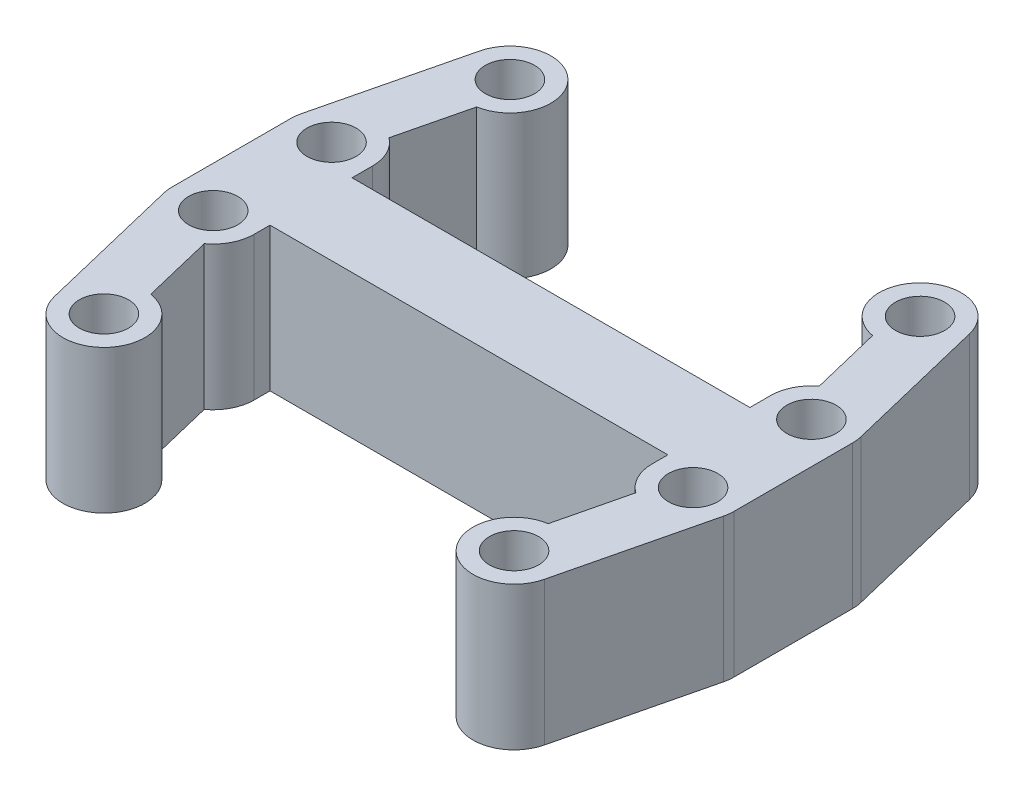
from build123d import *

# Parameters (mm, degrees)
SKETCH2_R           = 1.905
BOSS_EXTRUDE1_DEPTH = 11.1125


with BuildPart() as part:
    # Sketch2 → Boss-Extrude1 (new body)
    with BuildSketch(Plane(origin=(0, 0, 0), x_dir=(1, 0, 0), z_dir=(0, 1, 0))):
        with BuildLine():
            Line((-16.652885777, 7.290524058), (-15.327609815, 12.747542729))
            ThreePointArc((-15.327609815, 12.747542729), (-13.558199469, 18.045958382), (-18.96031801, 16.624291517))
            Line((-18.96031801, 16.624291517), (-21.65906801, 5.511791517))
            ThreePointArc((-21.65906801, 5.511791517), (-21.726249777, 5.139819704), (-21.74875, 4.7625))
            Line((-21.74875, 4.7625), (-21.74875, -4.397375))
            ThreePointArc((-21.74875, -4.397375), (-21.726434075, -4.773151689), (-21.659800003, -5.143645982))
            Line((-21.659800003, -5.143645982), (-18.961050003, -16.303770982))
            ThreePointArc((-18.961050003, -16.303770982), (-13.540192666, -17.709080747), (-15.382866617, -12.420872873))
            Line((-15.382866617, -12.420872873), (-16.702800144, -6.962559523))
            ThreePointArc((-16.702800144, -6.962559523), (-15.743476975, -5.836186872), (-15.39875, -4.397375))
            Line((-15.39875, -4.397375), (-15.39875, -3.175))
            Line((-15.39875, -3.175), (15.39875, -3.175))
            Line((15.39875, -3.175), (15.39875, -4.397375))
            ThreePointArc((15.39875, -4.397375), (15.743476975, -5.836186872), (16.702800144, -6.962559523))
            Line((16.702800144, -6.962559523), (15.382866617, -12.420872873))
            ThreePointArc((15.382866617, -12.420872873), (13.540192666, -17.709080747), (18.961050003, -16.303770982))
            Line((18.961050003, -16.303770982), (21.659800003, -5.143645982))
            ThreePointArc((21.659800003, -5.143645982), (21.726434075, -4.773151689), (21.74875, -4.397375))
            Line((21.74875, -4.397375), (21.74875, 4.7625))
            ThreePointArc((21.74875, 4.7625), (21.726249777, 5.139819704), (21.65906801, 5.511791517))
            Line((21.65906801, 5.511791517), (18.96031801, 16.624291517))
            ThreePointArc((18.96031801, 16.624291517), (13.558199469, 18.045958382), (15.327609815, 12.747542729))
            Line((15.327609815, 12.747542729), (16.652885777, 7.290524058))
            ThreePointArc((16.652885777, 7.290524058), (15.72951294, 6.173506926), (15.39875, 4.7625))
            Line((15.39875, 4.7625), (15.39875, 3.175))
            Line((15.39875, 3.175), (-15.39875, 3.175))
            Line((-15.39875, 3.175), (-15.39875, 4.7625))
            ThreePointArc((-15.39875, 4.7625), (-15.72951294, 6.173506926), (-16.652885777, 7.290524058))
        make_face()
        with Locations(Location((-15.875, 15.875, 0), (0, 0, 270))):
            Circle(SKETCH2_R, mode=Mode.SUBTRACT)
        with Locations(Location((-18.57375, 4.7625, 0), (0, 0, 270))):
            Circle(SKETCH2_R, mode=Mode.SUBTRACT)
        with Locations(Location((-18.57375, -4.397375, 0), (0, 0, 90))):
            Circle(SKETCH2_R, mode=Mode.SUBTRACT)
        with Locations(Location((-15.875, -15.5575, 0), (0, 0, 90))):
            Circle(SKETCH2_R, mode=Mode.SUBTRACT)
        with Locations(Location((15.875, -15.5575, 0), (0, 0, 270))):
            Circle(SKETCH2_R, mode=Mode.SUBTRACT)
        with Locations(Location((18.57375, -4.397375, 0), (0, 0, 270))):
            Circle(SKETCH2_R, mode=Mode.SUBTRACT)
        with Locations(Location((18.57375, 4.7625, 0), (0, 0, 90))):
            Circle(SKETCH2_R, mode=Mode.SUBTRACT)
        with Locations(Location((15.875, 15.875, 0), (0, 0, 90))):
            Circle(SKETCH2_R, mode=Mode.SUBTRACT)
    extrude(amount=BOSS_EXTRUDE1_DEPTH)


solid = part.part
